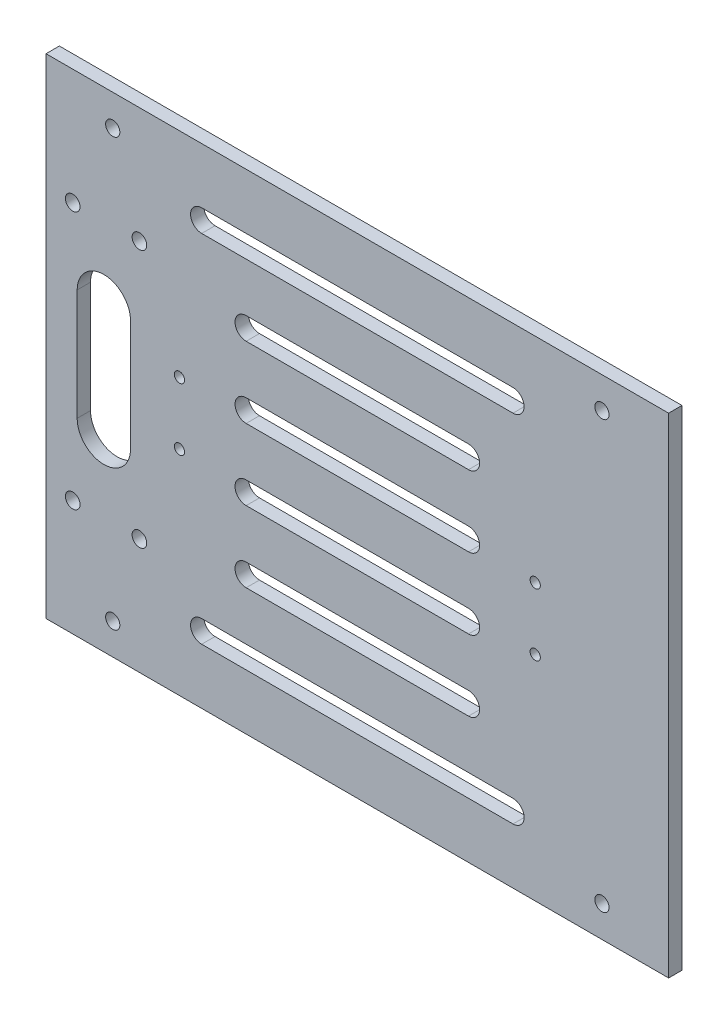
from build123d import *

# Parameters (mm, degrees)
SKETCH_1_W          = 140
SKETCH_1_H          = 110
EXTRUDE_1_DEPTH     = 3
SKETCH_2_R          = 1.65
CUT_EXTRUDE_1_DEPTH = 90.073003767
SKETCH_3_R          = 1.15
CUT_EXTRUDE_2_DEPTH = 90.073003767
CUT_EXTRUDE_3_DEPTH = 10
CUT_EXTRUDE_4_DEPTH = 10
CUT_EXTRUDE_5_DEPTH = 10
SKETCH_8_R          = 1.6
CUT_EXTRUDE_6_DEPTH = 10


with BuildPart() as part:
    # 草图1 → 凸台-拉伸1 (new body)
    with BuildSketch(Plane.XY):
        Rectangle(SKETCH_1_W, SKETCH_1_H)
    extrude(amount=EXTRUDE_1_DEPTH)

    # 草图2 → 切除-拉伸1 (cut, through all)
    with BuildSketch(Plane(origin=(0, 0, 0), x_dir=(-1, 0, 0), z_dir=(0, 0, -1))):
        with Locations((64, 29)):
            Circle(SKETCH_2_R)
        with Locations((64, -29)):
            Circle(SKETCH_2_R)
        with Locations((49, 29)):
            Circle(SKETCH_2_R)
        with Locations((49, -29)):
            Circle(SKETCH_2_R)
    extrude(amount=-CUT_EXTRUDE_1_DEPTH, mode=Mode.SUBTRACT)

    # 草图3 → 切除-拉伸2 (cut, through all)
    with BuildSketch(Plane(origin=(0, 0, 0), x_dir=(-1, 0, 0), z_dir=(0, 0, -1))):
        with Locations((-40, 7)):
            Circle(SKETCH_3_R)
        with Locations((-40, -7)):
            Circle(SKETCH_3_R)
        with Locations((40, 7)):
            Circle(SKETCH_3_R)
        with Locations((40, -7)):
            Circle(SKETCH_3_R)
    extrude(amount=-CUT_EXTRUDE_2_DEPTH, mode=Mode.SUBTRACT)

    # 草图4 → 切除-拉伸3 (cut)
    with BuildSketch(Plane.XY.offset(3)):
        with BuildLine():
            Line((-25, 42.5), (25, 42.5))
            ThreePointArc((25, 42.5), (27.5, 40), (25, 37.5))
            Line((25, 37.5), (-25, 37.5))
            ThreePointArc((-25, 37.5), (-27.5, 40), (-25, 42.5))
        make_face()
        with BuildLine():
            Line((-25, 26.5), (25, 26.5))
            ThreePointArc((25, 26.5), (27.5, 24), (25, 21.5))
            Line((25, 21.5), (-25, 21.5))
            ThreePointArc((-25, 21.5), (-27.5, 24), (-25, 26.5))
        make_face()
        with BuildLine():
            Line((-25, 10.5), (25, 10.5))
            ThreePointArc((25, 10.5), (27.5, 8), (25, 5.5))
            Line((25, 5.5), (-25, 5.5))
            ThreePointArc((-25, 5.5), (-27.5, 8), (-25, 10.5))
        make_face()
        with BuildLine():
            Line((-25, -5.5), (25, -5.5))
            ThreePointArc((25, -5.5), (27.5, -8), (25, -10.5))
            Line((25, -10.5), (-25, -10.5))
            ThreePointArc((-25, -10.5), (-27.5, -8), (-25, -5.5))
        make_face()
        with BuildLine():
            Line((-25, -21.5), (25, -21.5))
            ThreePointArc((25, -21.5), (27.5, -24), (25, -26.5))
            Line((25, -26.5), (-25, -26.5))
            ThreePointArc((-25, -26.5), (-27.5, -24), (-25, -21.5))
        make_face()
        with BuildLine():
            Line((-25, -37.5), (25, -37.5))
            ThreePointArc((25, -37.5), (27.5, -40), (25, -42.5))
            Line((25, -42.5), (-25, -42.5))
            ThreePointArc((-25, -42.5), (-27.5, -40), (-25, -37.5))
        make_face()
    extrude(amount=-CUT_EXTRUDE_3_DEPTH, mode=Mode.SUBTRACT)

    # 草图5 → 切除-拉伸4 (cut)
    with BuildSketch(Plane.XY.offset(3)):
        with BuildLine():
            Line((-35, 42.5), (35, 42.5))
            ThreePointArc((35, 42.5), (37.5, 40), (35, 37.5))
            Line((35, 37.5), (-35, 37.5))
            ThreePointArc((-35, 37.5), (-37.5, 40), (-35, 42.5))
        make_face()
    cut_extrude_4 = extrude(amount=-CUT_EXTRUDE_4_DEPTH, mode=Mode.SUBTRACT)

    # 镜向1: 切除-拉伸4 across plane
    add(cut_extrude_4.mirror(Plane.ZX), mode=Mode.SUBTRACT)

    # 草图7 → 切除-拉伸5 (cut)
    with BuildSketch(Plane.XY.offset(3)):
        with BuildLine():
            Line((-63, -12.5), (-63, 12.5))
            ThreePointArc((-63, 12.5), (-57, 18.5), (-51, 12.5))
            Line((-51, 12.5), (-51, -12.5))
            ThreePointArc((-51, -12.5), (-57, -18.5), (-63, -12.5))
        make_face()
    extrude(amount=-CUT_EXTRUDE_5_DEPTH, mode=Mode.SUBTRACT)

    # 草图8 → 切除-拉伸6 (cut)
    with BuildSketch(Plane.XY.offset(3)):
        with Locations((55, -48)):
            Circle(SKETCH_8_R)
        with Locations((-55, -48)):
            Circle(SKETCH_8_R)
        with Locations((-55, 48)):
            Circle(SKETCH_8_R)
        with Locations((55, 48)):
            Circle(SKETCH_8_R)
    extrude(amount=-CUT_EXTRUDE_6_DEPTH, mode=Mode.SUBTRACT)


solid = part.part
